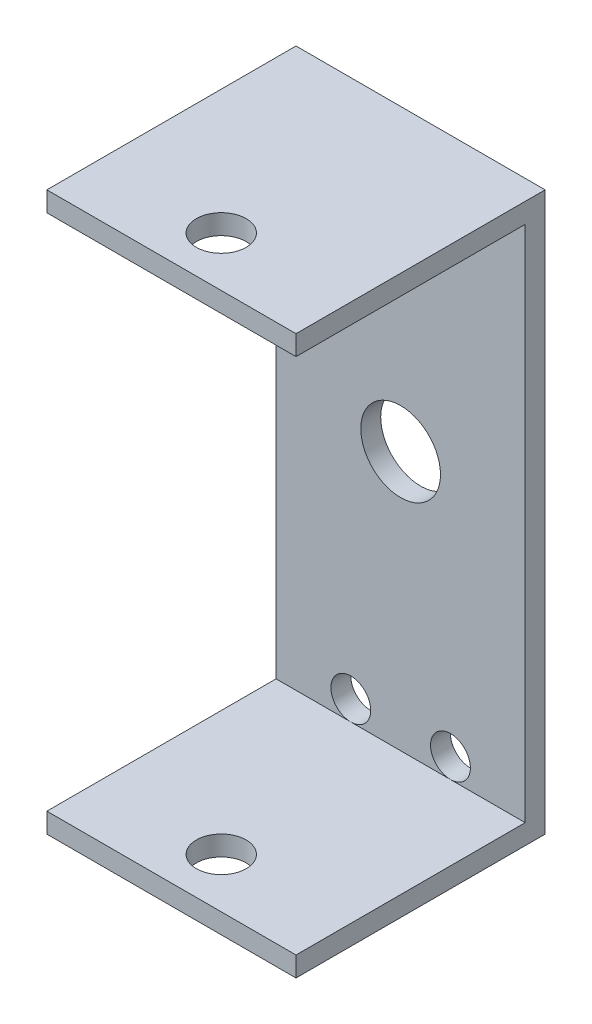
from build123d import *

# Parameters (mm, degrees)
SKETCH1_W           = 25
SKETCH1_H           = 52
BOSS_EXTRUDE1_DEPTH = 2
SKETCH2_W           = 25
SKETCH2_H           = 25
BOSS_EXTRUDE2_DEPTH = 2
SKETCH3_W           = 25
SKETCH3_H           = 25
BOSS_EXTRUDE3_DEPTH = 2
SKETCH5_R           = 4
CUT_EXTRUDE2_DEPTH  = 21
SKETCH7_R           = 2.5
CUT_EXTRUDE4_DEPTH  = 84
SKETCH8_R           = 2
CUT_EXTRUDE5_DEPTH  = 10


with BuildPart() as part:
    # Sketch1 → Boss-Extrude1 (new body)
    with BuildSketch(Plane.XY):
        with Locations((-0.174770451, 4.502942624)):
            Rectangle(SKETCH1_W, SKETCH1_H)
    extrude(amount=BOSS_EXTRUDE1_DEPTH)

    # Sketch2 → Boss-Extrude2 (add)
    with BuildSketch(Plane(origin=(0, 30.502942624, 0), x_dir=(1, 0, 0), z_dir=(0, 1, 0))):
        with Locations((-0.174770451, -12.5)):
            Rectangle(SKETCH2_W, SKETCH2_H)
    extrude(amount=BOSS_EXTRUDE2_DEPTH)

    # Sketch3 → Boss-Extrude3 (add)
    with BuildSketch(Plane(origin=(0, -21.497057376, 0), x_dir=(-1, 0, 0), z_dir=(0, -1, 0))):
        with Locations((0.174770451, -12.5)):
            Rectangle(SKETCH3_W, SKETCH3_H)
    extrude(amount=BOSS_EXTRUDE3_DEPTH)

    # Sketch5 → Cut-Extrude2 (cut)
    with BuildSketch(Plane(origin=(0, 0, 0), x_dir=(-1, 0, 0), z_dir=(0, 0, -1))):
        with Locations((0.174770451, 4.502942624)):
            Circle(SKETCH5_R)
    extrude(amount=-CUT_EXTRUDE2_DEPTH, mode=Mode.SUBTRACT)

    # Sketch7 → Cut-Extrude4 (cut)
    with BuildSketch(Plane(origin=(0, -23.497057376, 0), x_dir=(-1, 0, 0), z_dir=(0, -1, 0))):
        with Locations(Location((0.174770451, -20, 0), (0, 0, 90))):
            Circle(SKETCH7_R)
    extrude(amount=-CUT_EXTRUDE4_DEPTH, mode=Mode.SUBTRACT)

    # Sketch8 → Cut-Extrude5 (cut)
    with BuildSketch(Plane(origin=(0, 0, 0), x_dir=(-1, 0, 0), z_dir=(0, 0, -1))):
        with Locations((5.174770451, -19.497057376)):
            Circle(SKETCH8_R)
        with Locations((-4.825229549, -19.497057376)):
            Circle(SKETCH8_R)
        with Locations((-4.825229549, 28.502942624)):
            Circle(SKETCH8_R)
        with Locations((5.174770451, 28.502942624)):
            Circle(SKETCH8_R)
    extrude(amount=-CUT_EXTRUDE5_DEPTH, mode=Mode.SUBTRACT)


solid = part.part
